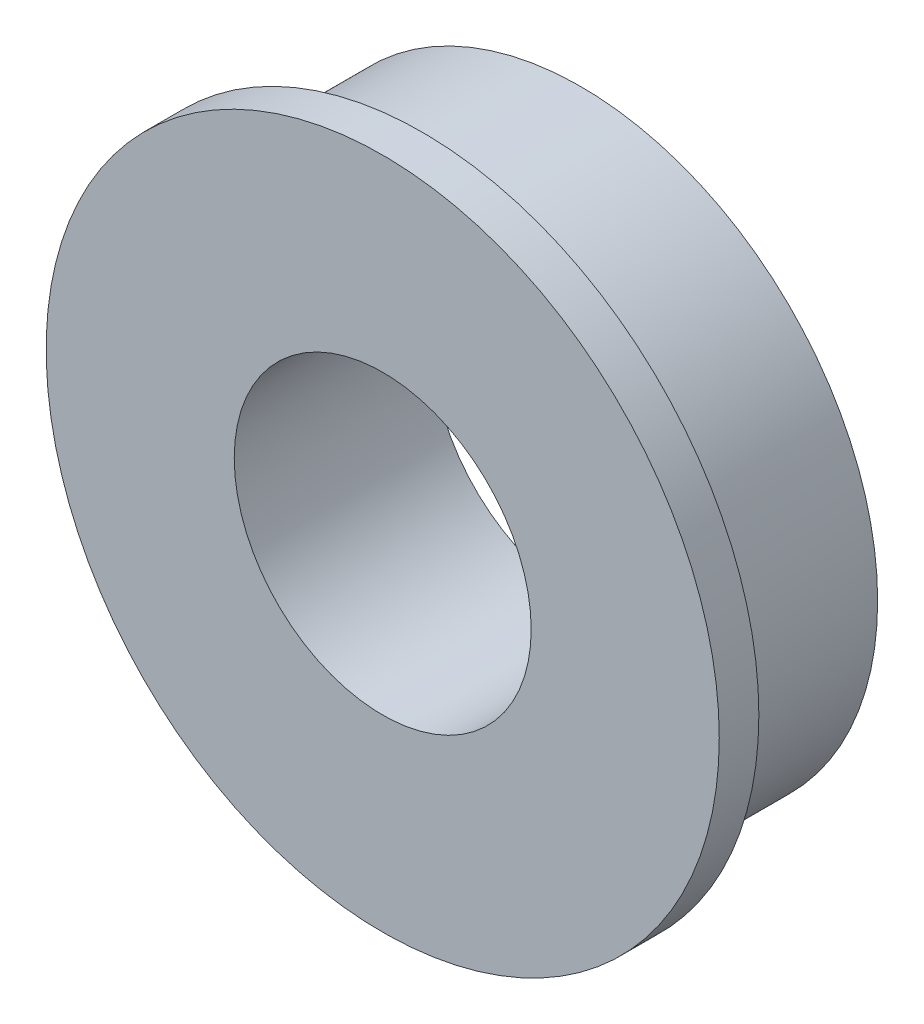
from build123d import *

# Parameters (mm, degrees)
SKETCH_1_R      = 6
SKETCH_1_R_2    = 3
EXTRUDE_1_DEPTH = 4
EXTRUDE_START   = -0.8
SKETCH_2_R      = 6.8
SKETCH_2_R_2    = 3
EXTRUDE_2_DEPTH = 0.8


with BuildPart() as part:
    # 草图1 → 凸台-拉伸1 (new body)
    with BuildSketch(Plane.XY):
        Circle(SKETCH_1_R)
        Circle(SKETCH_1_R_2, mode=Mode.SUBTRACT)
    extrude(amount=EXTRUDE_1_DEPTH)

    # 草图2 → 凸台-拉伸2 (add)
    with BuildSketch(Plane.XY.offset(4).offset(EXTRUDE_START)):
        Circle(SKETCH_2_R)
        Circle(SKETCH_2_R_2, mode=Mode.SUBTRACT)
    extrude(amount=EXTRUDE_2_DEPTH)


solid = part.part
